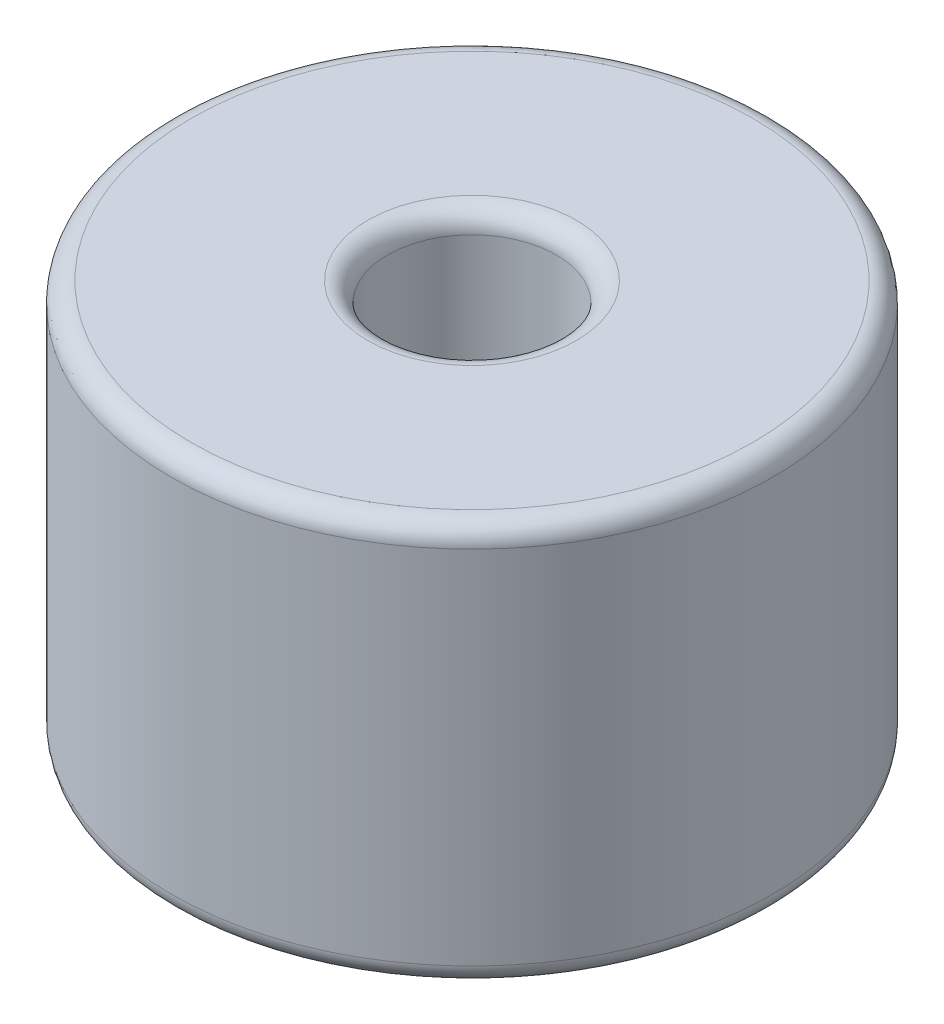
from build123d import *

# Parameters (mm, degrees)
SKETCH1_R           = 7.5
SKETCH1_R_2         = 2.1
BOSS_EXTRUDE1_DEPTH = 10
FILLET1_R           = 0.5


with BuildPart() as part:
    # Sketch1 → Boss-Extrude1 (new body)
    with BuildSketch(Plane(origin=(0, 0, 0), x_dir=(1, 0, 0), z_dir=(0, 1, 0))):
        with Locations(Location((0, 0, 0), (0, 0, 270))):
            Circle(SKETCH1_R)
        with Locations(Location((0, 0, 0), (0, 0, 270))):
            Circle(SKETCH1_R_2, mode=Mode.SUBTRACT)
    extrude(amount=BOSS_EXTRUDE1_DEPTH)

    # Fillet1
    fillet1_edges = [part.edges().sort_by_distance(p)[0] for p in [
        (0, 0, -7.5),
        (0, 10, -7.5),
        (0, 0, -2.1),
        (0, 10, -2.1),
    ]]
    fillet(fillet1_edges, radius=FILLET1_R)


solid = part.part
